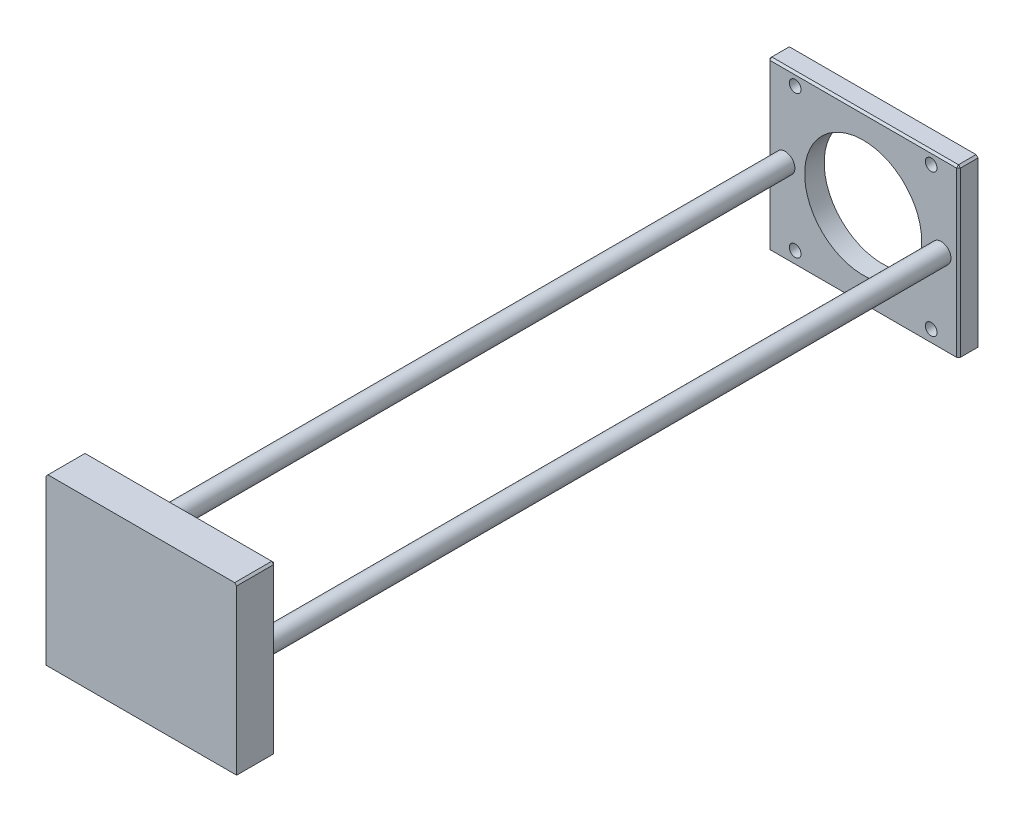
from build123d import *

# Parameters (mm, degrees)
CROQUIS1_W              = 97.7
CROQUIS1_H              = 85
CROQUIS1_R              = 3
CROQUIS1_R_2            = 30
SALIENTE_EXTRUIR1_DEPTH = 10
CROQUIS2_R              = 5
SALIENTE_EXTRUIR2_DEPTH = 350
CROQUIS3_W              = 97.7
CROQUIS3_H              = 85
SALIENTE_EXTRUIR3_DEPTH = 20
CHAFL_N1_SIZE           = 1


with BuildPart() as part:
    # Croquis1 → Saliente-Extruir1 (new body)
    with BuildSketch(Plane.XY):
        Rectangle(CROQUIS1_W, CROQUIS1_H)
        with Locations((-34.85, 36.5)):
            Circle(CROQUIS1_R, mode=Mode.SUBTRACT)
        Circle(CROQUIS1_R_2, mode=Mode.SUBTRACT)
        with Locations(Location((34.85, 36.5, 0), (0, 0, 180))):
            Circle(CROQUIS1_R, mode=Mode.SUBTRACT)
        with Locations((34.85, -36.5)):
            Circle(CROQUIS1_R, mode=Mode.SUBTRACT)
        with Locations(Location((-34.85, -36.5, 0), (0, 0, 180))):
            Circle(CROQUIS1_R, mode=Mode.SUBTRACT)
    extrude(amount=SALIENTE_EXTRUIR1_DEPTH)

    # Croquis2 → Saliente-Extruir2 (add)
    with BuildSketch(Plane.XY.offset(10)):
        with Locations((-40, 0)):
            Circle(CROQUIS2_R)
        with Locations(Location((40, 0, 0), (0, 0, 180))):
            Circle(CROQUIS2_R)
    extrude(amount=SALIENTE_EXTRUIR2_DEPTH)

    # Croquis3 → Saliente-Extruir3 (add)
    with BuildSketch(Plane.XY.offset(360)):
        Rectangle(CROQUIS3_W, CROQUIS3_H)
    extrude(amount=SALIENTE_EXTRUIR3_DEPTH)

    # Chaflán1
    chafl_n1_edges = [part.edges().sort_by_distance(p)[0] for p in [
        (48.85, 0, 10),
        (0, 42.5, 10),
        (-48.85, 0, 360),
        (-48.85, 42.5, 370),
        (48.85, 0, 360),
        (0, 42.5, 360),
        (48.85, 42.5, 370),
        (-48.85, 0, 10),
        (-48.85, 42.5, 5),
        (48.85, 42.5, 5),
    ]]
    chamfer(chafl_n1_edges, length=CHAFL_N1_SIZE)


solid = part.part
